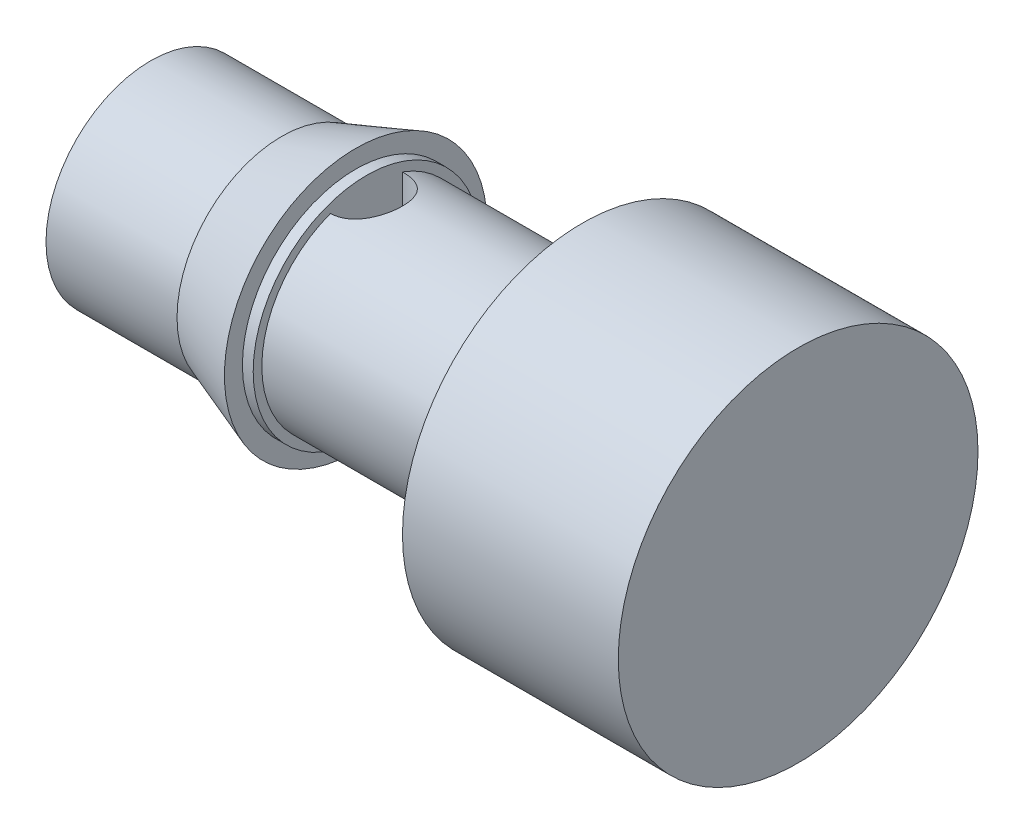
from build123d import *

# Parameters (mm, degrees)
SKETCH2_R               = 1.455
BOSS_EXTRUDE3_DEPTH     = 6
SKETCH3_R               = 2.5
BOSS_EXTRUDE4_DEPTH     = 3
CUT_EXTRUDE1_DEPTH      = 10.669539803
CUT_EXTRUDE1_DEPTH_BACK = 10.669539803
SKETCH4_R               = 0.5
SKETCH6_R               = 1.575
BOSS_EXTRUDE5_DEPTH     = 0.15


with BuildPart() as part:
    # Sketch2 → Boss-Extrude3 (new body)
    with BuildSketch(Plane(origin=(0, 0, 0), x_dir=(0, 0, -1), z_dir=(1, 0, 0))):
        Circle(SKETCH2_R)
    extrude(amount=BOSS_EXTRUDE3_DEPTH)

    # Sketch3 → Boss-Extrude4 (add)
    with BuildSketch(Plane(origin=(6, 0, 0), x_dir=(0, 0, -1), z_dir=(1, 0, 0))):
        Circle(SKETCH3_R)
    extrude(amount=BOSS_EXTRUDE4_DEPTH)

    # Sketch4 → Cut-Extrude1 (cut, two sides: drawn at the far end of the back side and taken through both)
    with BuildSketch(Plane(origin=(0, 0, 0), x_dir=(1, 0, 0), z_dir=(0, 1, 0)).offset(-CUT_EXTRUDE1_DEPTH_BACK)):
        with Locations(Location((3, 0, 0), (0, 0, 270))):
            Circle(SKETCH4_R)
    extrude(amount=CUT_EXTRUDE1_DEPTH + CUT_EXTRUDE1_DEPTH_BACK, mode=Mode.SUBTRACT)

    # Sketch6 → Boss-Extrude5 (add)
    with BuildSketch(Plane.ZY.offset(-3)):
        Circle(SKETCH6_R)
    extrude(amount=BOSS_EXTRUDE5_DEPTH)

    # Sketch7 → Revolve1 (revolve)
    with BuildSketch(Plane.XY, mode=Mode.PRIVATE) as revolve1_sk:
        Polygon((2.85, 1.825), (0, 0.8), (2.85, 0.8), align=None)
    revolve(revolve1_sk.sketch.rotate(Axis((9.45, 0, 0), (-1, 0, 0)), 90), axis=Axis((9.45, 0, 0), (-1, 0, 0)))


solid = part.part
